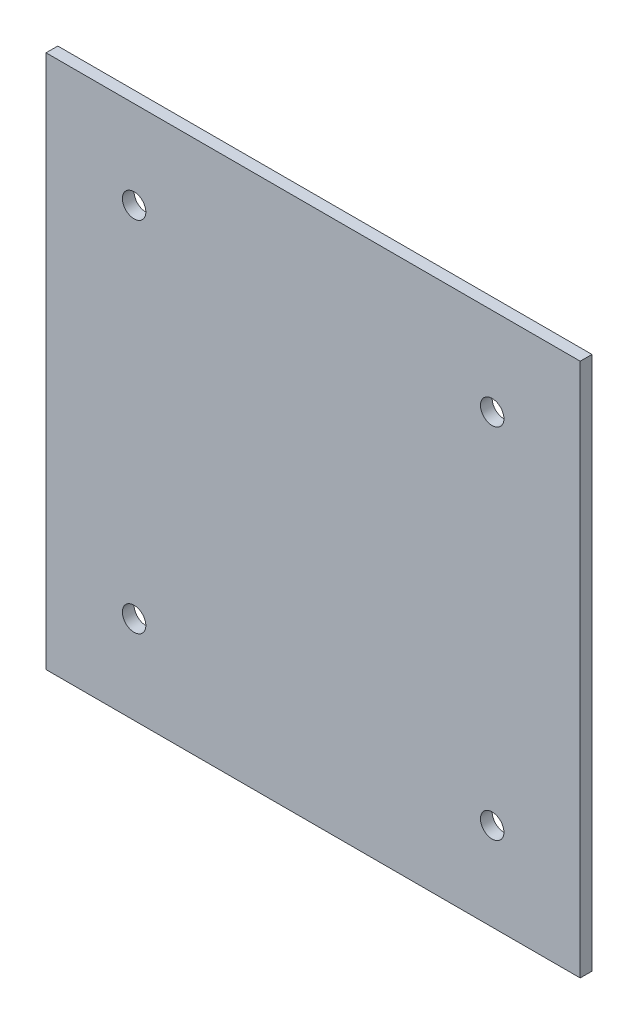
from build123d import *

# Parameters (mm, degrees)
CROQUIS1_W              = 182
CROQUIS1_H              = 182
SALIENTE_EXTRUIR1_DEPTH = 2
CROQUIS2_R              = 4
CORTAR_EXTRUIR1_DEPTH   = 4


with BuildPart() as part:
    # Croquis1 → Saliente-Extruir1 (new, symmetric)
    with BuildSketch(Plane.XY):
        with Locations((91, 91)):
            Rectangle(CROQUIS1_W, CROQUIS1_H)
    extrude(amount=SALIENTE_EXTRUIR1_DEPTH, both=True)

    # Croquis2 → Cortar-Extruir1 (cut)
    with BuildSketch(Plane.XY.offset(2)):
        with Locations((30, 152)):
            Circle(CROQUIS2_R)
        with Locations((152, 152)):
            Circle(CROQUIS2_R)
        with Locations((152, 30)):
            Circle(CROQUIS2_R)
        with Locations((30, 30)):
            Circle(CROQUIS2_R)
    extrude(amount=-CORTAR_EXTRUIR1_DEPTH, mode=Mode.SUBTRACT)


solid = part.part
